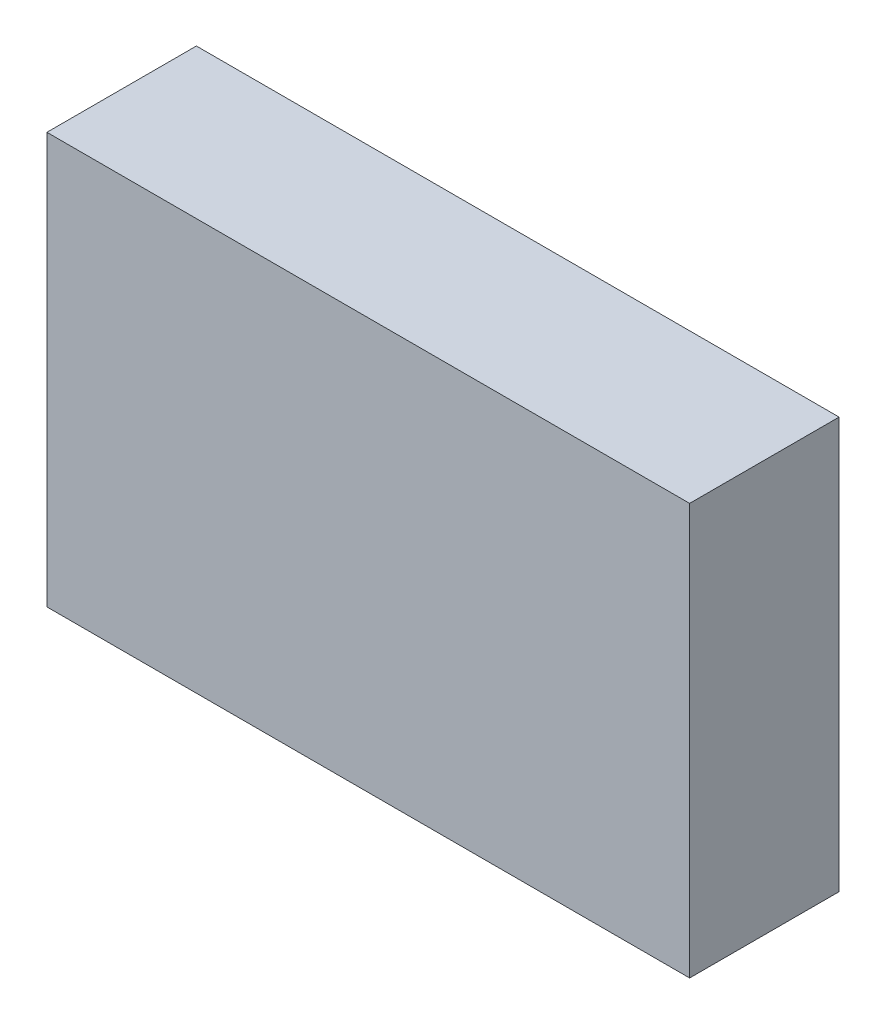
from build123d import *

# Parameters (mm, degrees)
SKETCH_1_W      = 86
SKETCH_1_H      = 20
EXTRUDE_1_DEPTH = 55


with BuildPart() as part:
    # 草图1 → 凸台-拉伸1 (new body)
    with BuildSketch(Plane(origin=(0, 0, 0), x_dir=(1, 0, 0), z_dir=(0, 1, 0))):
        with Locations((43, -10)):
            Rectangle(SKETCH_1_W, SKETCH_1_H)
    extrude(amount=EXTRUDE_1_DEPTH)


solid = part.part
